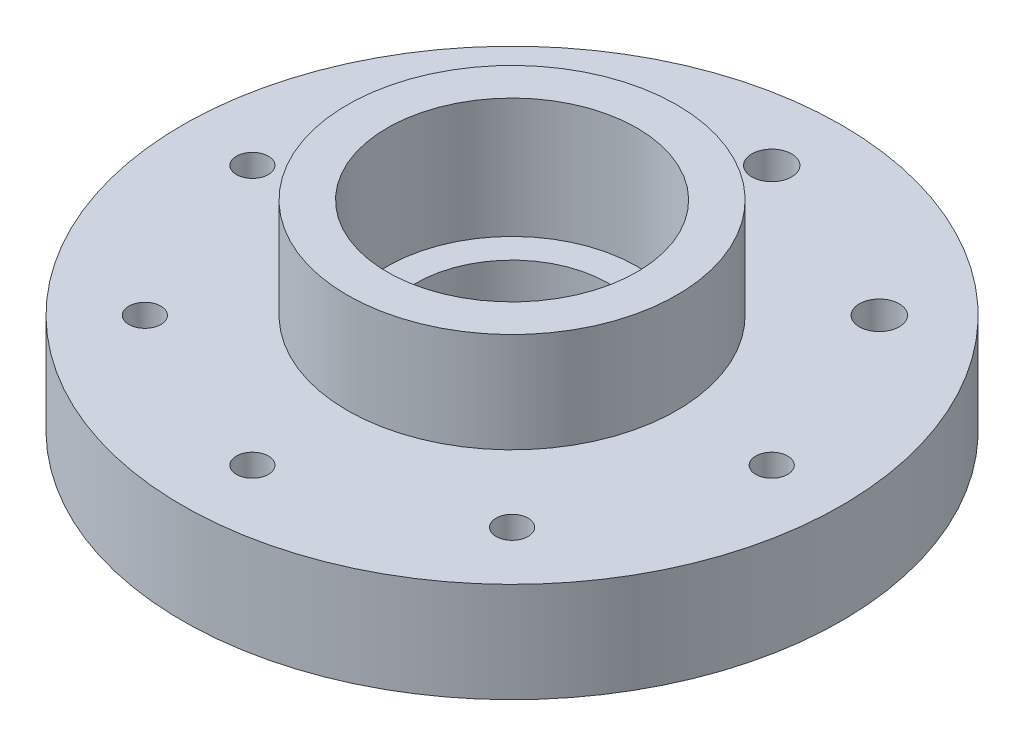
from build123d import *

# Parameters (mm, degrees)
SKETCH3_R          = 4
SKETCH3_R_2        = 5
CUT_EXTRUDE2_DEPTH = 127.935022748


with BuildPart() as part:
    # Sketch2 → Revolve1 (revolve)
    with BuildSketch(Plane.XY, mode=Mode.PRIVATE) as revolve1_sk:
        Polygon((82.5, 0), (56, 0), (56, 6), (24, 6), (24, 20), (31.256462168, 20), (31.256462168, 50), (41.256462168, 50), (41.256462168, 25), (82.5, 25), align=None)
    revolve(revolve1_sk.sketch.rotate(Axis((0, 0, 0), (0, 1, 0)), 90), axis=Axis((0, 0, 0), (0, 1, 0)))

    # Sketch3 → Cut-Extrude2 (cut, through all)
    with BuildSketch(Plane.XZ):
        with Locations(Location((65, 0, 0), (0, 0, 270))):
            Circle(SKETCH3_R)
        with Locations(Location((45.961940777, -45.961940777, 0), (0, 0, 270))):
            Circle(SKETCH3_R_2)
        with Locations(Location((0, -65, 0), (0, 0, 270))):
            Circle(SKETCH3_R_2)
        with Locations(Location((-45.961940777, -45.961940777, 0), (0, 0, 270))):
            Circle(SKETCH3_R_2)
        with Locations(Location((-65, 0, 0), (0, 0, 270))):
            Circle(SKETCH3_R)
        with Locations(Location((-45.961940777, 45.961940777, 0), (0, 0, 270))):
            Circle(SKETCH3_R)
        with Locations(Location((0, 65, 0), (0, 0, 270))):
            Circle(SKETCH3_R)
        with Locations(Location((45.961940777, 45.961940777, 0), (0, 0, 270))):
            Circle(SKETCH3_R)
    extrude(amount=-CUT_EXTRUDE2_DEPTH, mode=Mode.SUBTRACT)


solid = part.part
